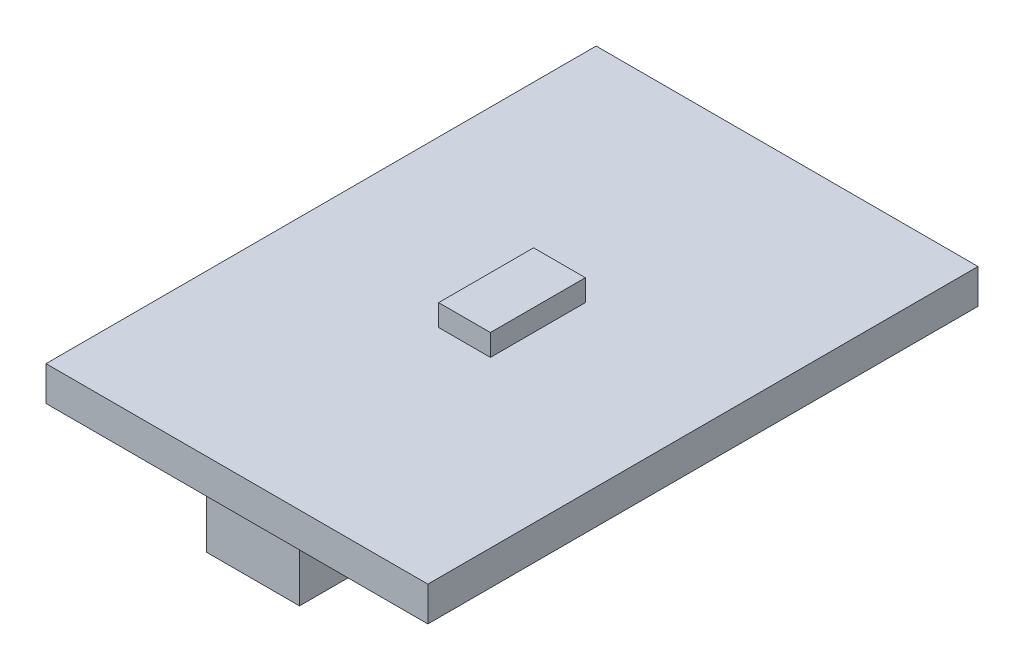
from build123d import *

# Parameters (mm, degrees)
SK_BOARD_W              = 17.7
SK_BOARD_H              = 25.5
EX_BOARD_DEPTH          = 1.6
SK_SENSOR_W             = 2.4
SK_SENSOR_H             = 4.4
EX_SENSOR_DEPTH         = 1
SK_KEEPOUT_STEMMA_W     = 4.3
SK_KEEPOUT_STEMMA_H     = 6
EX_KEEPOUT_STEMMA_DEPTH = 3


with BuildPart() as part:
    # SK_Board → EX_Board (new body)
    with BuildSketch(Plane(origin=(0, 0, 0), x_dir=(1, 0, 0), z_dir=(0, 1, 0))):
        Rectangle(SK_BOARD_W, SK_BOARD_H)
    extrude(amount=EX_BOARD_DEPTH)

    # SK_Sensor → EX_Sensor (add)
    with BuildSketch(Plane(origin=(0, 1.6, 0), x_dir=(1, 0, 0), z_dir=(0, 1, 0))):
        Rectangle(SK_SENSOR_W, SK_SENSOR_H)
    extrude(amount=EX_SENSOR_DEPTH)

    # SK_KeepOut_STEMMA → EX_KeepOut_STEMMA (add)
    with BuildSketch(Plane(origin=(0, 0, 0), x_dir=(1, 0, 0), z_dir=(0, 1, 0))):
        with Locations((0, -9)):
            Rectangle(SK_KEEPOUT_STEMMA_W, SK_KEEPOUT_STEMMA_H)
        with Locations((0, 9)):
            Rectangle(SK_KEEPOUT_STEMMA_W, SK_KEEPOUT_STEMMA_H)
    extrude(amount=-EX_KEEPOUT_STEMMA_DEPTH)


solid = part.part
